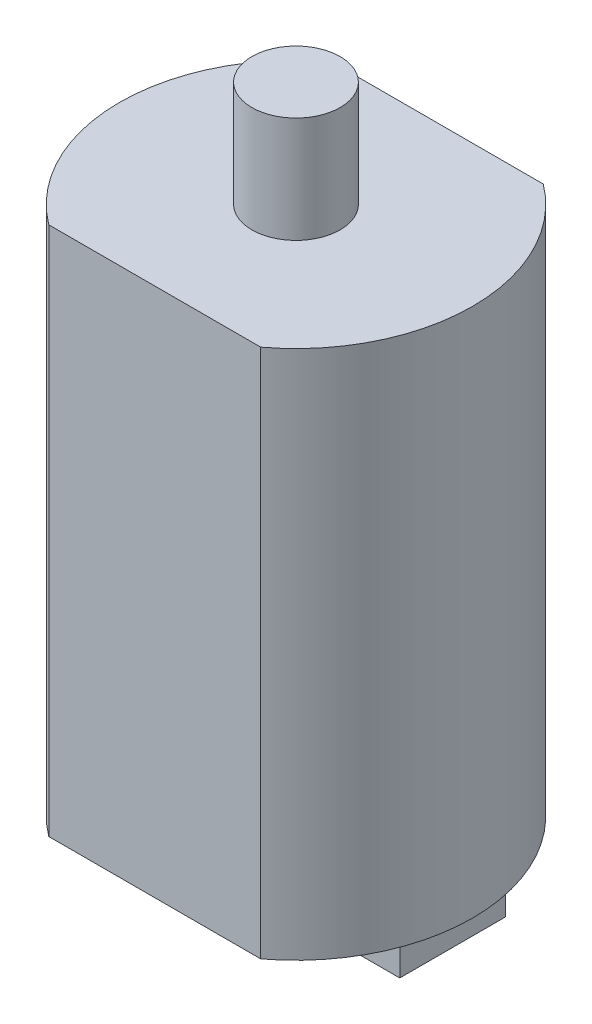
from build123d import *

# Parameters (mm, degrees)
SKETCH1_W           = 2
SKETCH1_H           = 3
SKETCH1_R           = 2
SKETCH1_R_2         = 1.25
BOSS_EXTRUDE1_DEPTH = 15
SKETCH1_3_W         = 2
SKETCH1_3_H         = 3
SKETCH1_3_R         = 2
SKETCH1_3_R_2       = 1.25
BOSS_EXTRUDE2_DEPTH = 1
BOSS_EXTRUDE3_START = 15
SKETCH1_4_R         = 1.25
BOSS_EXTRUDE3_DEPTH = 3


with BuildPart() as part:
    # Sketch1 → Boss-Extrude1 (new body)
    # profile 1 of 5: a face of its own
    with BuildSketch(Plane(origin=(0, 0, 0), x_dir=(1, 0, 0), z_dir=(0, 1, 0))):
        with BuildLine():
            Line((3, 4), (-3, 4))
            ThreePointArc((-3, 4), (-5, 0), (-3, -4))
            Line((-3, -4), (3, -4))
            ThreePointArc((3, -4), (4.472135955, -2.236067977), (5, 0))
            ThreePointArc((5, 0), (4.472135955, 2.236067977), (3, 4))
        make_face()
        with Locations((-3.4375, 0)):
            Rectangle(SKETCH1_W, SKETCH1_H, mode=Mode.SUBTRACT)
        Circle(SKETCH1_R, mode=Mode.SUBTRACT)
        with Locations((3.4375, 0)):
            Rectangle(SKETCH1_W, SKETCH1_H, mode=Mode.SUBTRACT)
    # profile 2 of 5: a face of its own
    with BuildSketch(Plane(origin=(0, 0, 0), x_dir=(1, 0, 0), z_dir=(0, 1, 0))):
        with Locations((-3.4375, 0)):
            Rectangle(SKETCH1_W, SKETCH1_H)
    # profile 3 of 5: a face of its own
    with BuildSketch(Plane(origin=(0, 0, 0), x_dir=(1, 0, 0), z_dir=(0, 1, 0))):
        Circle(SKETCH1_R)
        Circle(SKETCH1_R_2, mode=Mode.SUBTRACT)
    # profile 4 of 5: a face of its own
    with BuildSketch(Plane(origin=(0, 0, 0), x_dir=(1, 0, 0), z_dir=(0, 1, 0))):
        Circle(SKETCH1_R_2)
    # profile 5 of 5: a face of its own
    with BuildSketch(Plane(origin=(0, 0, 0), x_dir=(1, 0, 0), z_dir=(0, 1, 0))):
        with Locations((3.4375, 0)):
            Rectangle(SKETCH1_W, SKETCH1_H)
    extrude(amount=BOSS_EXTRUDE1_DEPTH)

    # Sketch1<3> → Boss-Extrude2 (add)
    # profile 1 of 4: a face of its own
    with BuildSketch(Plane(origin=(0, 0, 0), x_dir=(1, 0, 0), z_dir=(0, 1, 0))):
        with Locations((-3.4375, 0)):
            Rectangle(SKETCH1_3_W, SKETCH1_3_H)
    # profile 2 of 4: a face of its own
    with BuildSketch(Plane(origin=(0, 0, 0), x_dir=(1, 0, 0), z_dir=(0, 1, 0))):
        with Locations((3.4375, 0)):
            Rectangle(SKETCH1_3_W, SKETCH1_3_H)
    # profile 3 of 4: a face of its own
    with BuildSketch(Plane(origin=(0, 0, 0), x_dir=(1, 0, 0), z_dir=(0, 1, 0))):
        with Locations(Location((0, 0, 0), (0, 0, 270))):
            Circle(SKETCH1_3_R)
        Circle(SKETCH1_3_R_2, mode=Mode.SUBTRACT)
    # profile 4 of 4: a face of its own
    with BuildSketch(Plane(origin=(0, 0, 0), x_dir=(1, 0, 0), z_dir=(0, 1, 0))):
        Circle(SKETCH1_3_R_2)
    extrude(amount=-BOSS_EXTRUDE2_DEPTH)

    # Sketch1<4> → Boss-Extrude3 (add)
    with BuildSketch(Plane(origin=(0, 0, 0), x_dir=(1, 0, 0), z_dir=(0, 1, 0)).offset(BOSS_EXTRUDE3_START)):
        with Locations(Location((0, 0, 0), (0, 0, 270))):
            Circle(SKETCH1_4_R)
    extrude(amount=BOSS_EXTRUDE3_DEPTH)


solid = part.part
